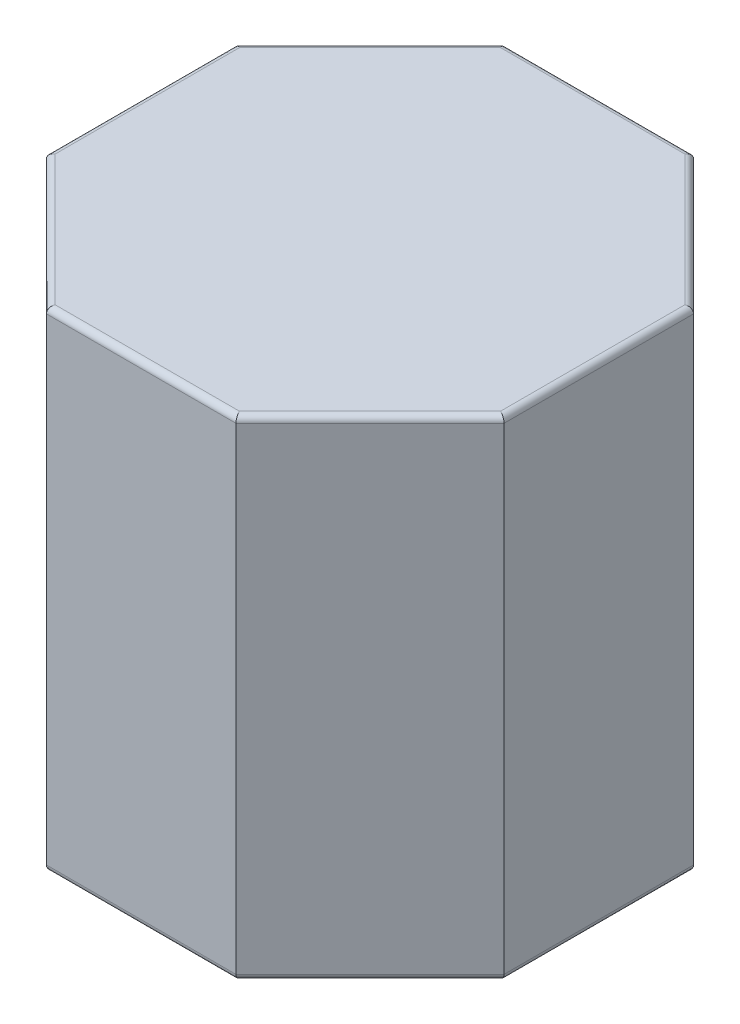
from build123d import *

# Parameters (mm, degrees)
BOSS_EXTRUDE1_DEPTH = 40
FILLET1_R           = 0.5


with BuildPart() as part:
    # Sketch1 → Boss-Extrude1 (new body)
    with BuildSketch(Plane(origin=(0, 0, 0), x_dir=(-1, 0, 0), z_dir=(0, 1, 0))):
        Polygon((7.745479892, -18.700646836), (-7.74610734, -18.700646836), (-18.700313724, -7.746440452), (-18.700313724, 7.745146781), (-7.74610734, 18.699353164), (7.745479892, 18.699353164), (18.699686276, 7.745146781), (18.699686276, -7.746440452), align=None)
    extrude(amount=BOSS_EXTRUDE1_DEPTH)

    # Fillet1
    fillet1_edges = [part.edges().sort_by_distance(p)[0] for p in [
        (0.000313724, 0, 18.699353164),
        (-13.222583084, 0, 13.222249973),
        (-18.699686276, 0, -0.000646836),
        (-13.222583084, 0, -13.223543644),
        (-13.222583084, 40, 13.222249973),
        (0.000313724, 40, 18.699353164),
        (13.223210532, 40, 13.222249973),
        (18.700313724, 40, -0.000646836),
        (13.223210532, 40, -13.223543644),
        (0.000313724, 40, -18.700646836),
        (-13.222583084, 40, -13.223543644),
        (0.000313724, 0, -18.700646836),
        (-18.699686276, 40, -0.000646836),
        (13.223210532, 0, -13.223543644),
        (18.700313724, 0, -0.000646836),
        (13.223210532, 0, 13.222249973),
    ]]
    fillet(fillet1_edges, radius=FILLET1_R)


solid = part.part
